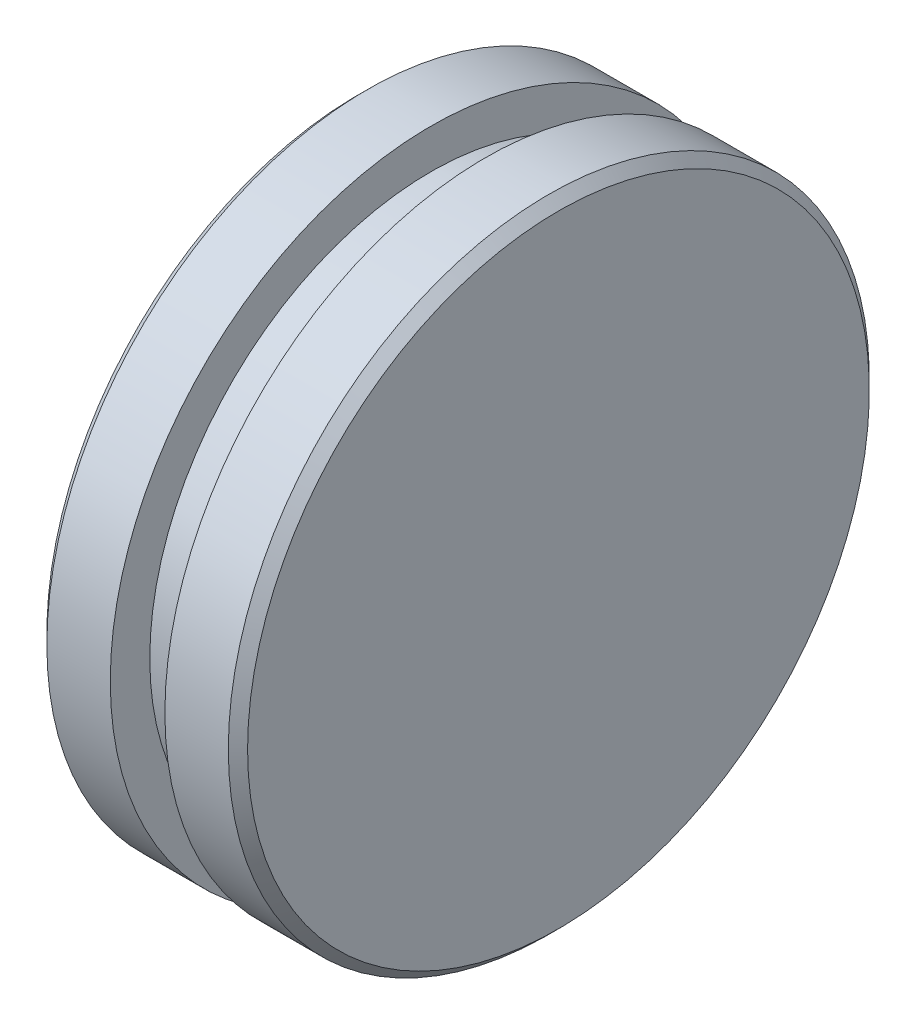
from build123d import *

# Parameters (mm, degrees)
CHAFL_N1_SIZE = 0.03


with BuildPart() as part:
    # Croquis1 → Revolución1 (revolve)
    with BuildSketch(Plane.XY, mode=Mode.PRIVATE) as revoluci_n1_sk:
        Polygon((0, 0.1875), (0.55, 0.1875), (0.55, 0.1), (0.55, 0), (0.625, 0), (0.625, 0.998), (0.3975, 0.998), (0.3975, 0.875), (0.2275, 0.875), (0.2275, 0.998), (0, 0.998), align=None)
    revolve(revoluci_n1_sk.sketch.rotate(Axis((0, 0, 0), (1, 0, 0)), 90), axis=Axis((0, 0, 0), (1, 0, 0)))

    # Chaflán1
    chafl_n1_edges = [part.edges().sort_by_distance(p)[0] for p in [
        (0, 0, -0.998),
        (0.625, 0, -0.998),
    ]]
    chamfer(chafl_n1_edges, length=CHAFL_N1_SIZE)


solid = part.part
